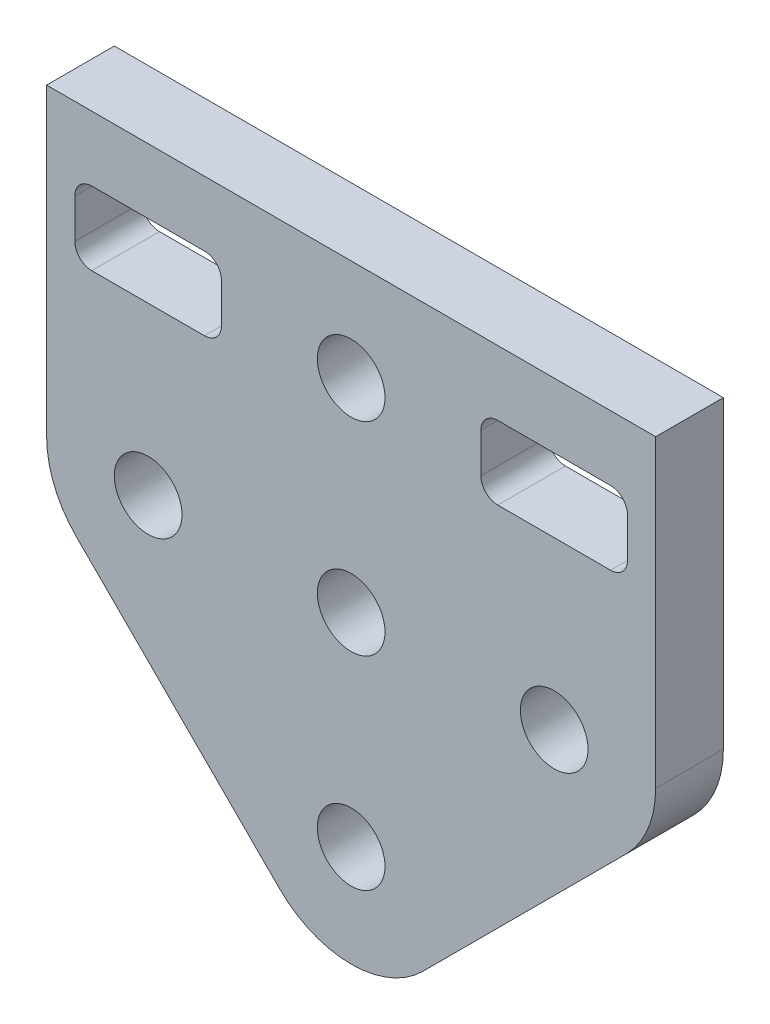
from build123d import *

# Parameters (mm, degrees)
MODEL_R                 = 1.5
SALIENTE_EXTRUIR1_DEPTH = 3


with BuildPart() as part:
    # Model → Saliente-Extruir1 (new body)
    with BuildSketch(Plane.XY):
        with BuildLine():
            Line((174.227054575, 213.178720063), (174.227054575, 204.178720063))
            ThreePointArc((174.227054575, 204.178720063), (174.569596678, 202.456644617), (175.545074059, 200.996739548))
            Line((175.545074059, 200.996739548), (184.545074059, 191.996739548))
            ThreePointArc((184.545074059, 191.996739548), (187.727054575, 190.678720063), (190.90903509, 191.996739548))
            Line((190.90903509, 191.996739548), (199.90903509, 200.996739548))
            ThreePointArc((199.90903509, 200.996739548), (200.884512471, 202.456644617), (201.227054575, 204.178720063))
            Line((201.227054575, 204.178720063), (201.227054575, 217.678720063))
            Line((201.227054575, 217.678720063), (174.227054575, 217.678720063))
            Line((174.227054575, 217.678720063), (174.227054575, 213.178720063))
        make_face()
        with Locations((187.727054575, 204.178720063)):
            Circle(MODEL_R, mode=Mode.SUBTRACT)
        with Locations((178.727054575, 204.178720063)):
            Circle(MODEL_R, mode=Mode.SUBTRACT)
        with Locations((187.727054575, 213.178720063)):
            Circle(MODEL_R, mode=Mode.SUBTRACT)
        with Locations((187.727054575, 195.178720063)):
            Circle(MODEL_R, mode=Mode.SUBTRACT)
        with Locations((196.727054575, 204.178720063)):
            Circle(MODEL_R, mode=Mode.SUBTRACT)
        with BuildLine():
            Line((193.477054575, 214.053720063), (193.477054575, 212.303720063))
            ThreePointArc((193.477054575, 212.303720063), (193.696724489, 211.773389977), (194.227054575, 211.553720063))
            Line((194.227054575, 211.553720063), (199.227054575, 211.553720063))
            ThreePointArc((199.227054575, 211.553720063), (199.757384661, 211.773389977), (199.977054575, 212.303720063))
            Line((199.977054575, 212.303720063), (199.977054575, 214.053720063))
            ThreePointArc((199.977054575, 214.053720063), (199.757384661, 214.584050149), (199.227054575, 214.803720063))
            Line((199.227054575, 214.803720063), (194.227054575, 214.803720063))
            ThreePointArc((194.227054575, 214.803720063), (193.696724489, 214.584050149), (193.477054575, 214.053720063))
        make_face(mode=Mode.SUBTRACT)
        with BuildLine():
            Line((175.477054575, 214.053720063), (175.477054575, 212.303720063))
            ThreePointArc((175.477054575, 212.303720063), (175.696724489, 211.773389977), (176.227054575, 211.553720063))
            Line((176.227054575, 211.553720063), (181.227054575, 211.553720063))
            ThreePointArc((181.227054575, 211.553720063), (181.757384661, 211.773389977), (181.977054575, 212.303720063))
            Line((181.977054575, 212.303720063), (181.977054575, 214.053720063))
            ThreePointArc((181.977054575, 214.053720063), (181.757384661, 214.584050149), (181.227054575, 214.803720063))
            Line((181.227054575, 214.803720063), (176.227054575, 214.803720063))
            ThreePointArc((176.227054575, 214.803720063), (175.696724489, 214.584050149), (175.477054575, 214.053720063))
        make_face(mode=Mode.SUBTRACT)
    extrude(amount=SALIENTE_EXTRUIR1_DEPTH)


solid = part.part
